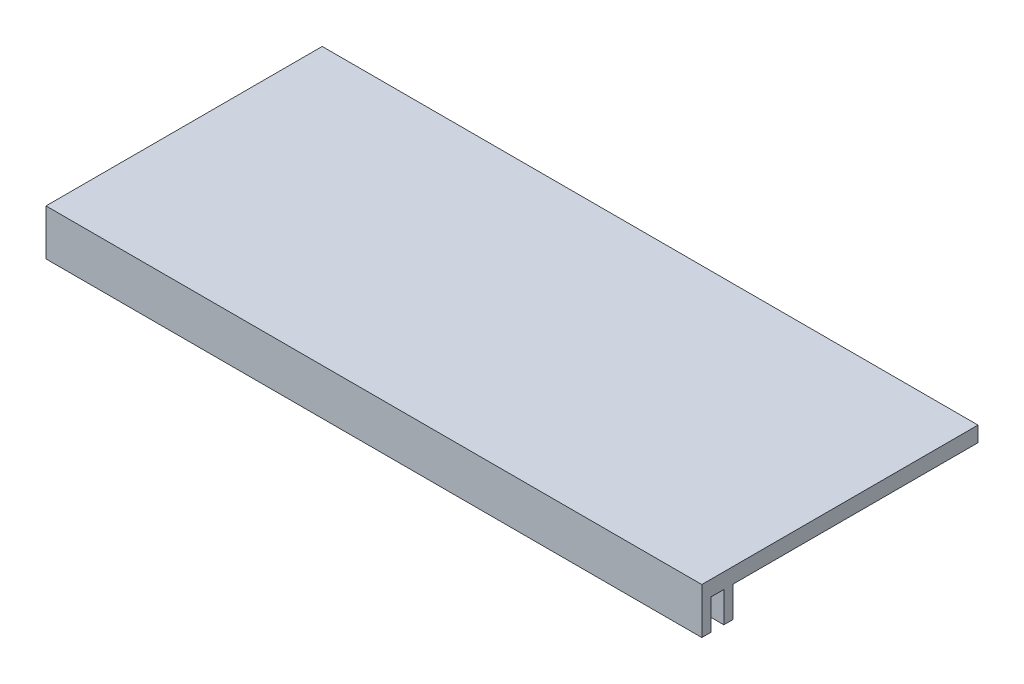
from build123d import *

# Parameters (mm, degrees)
SKETCH1_W                = 20
SKETCH1_H                = 80
BOSS_EXTRUDE1_DEPTH      = 5
BOSS_EXTRUDE2_DEPTH      = 10
BOSS_EXTRUDE2_DEPTH_BACK = 5
SKETCH2_W                = 20
SKETCH2_H                = 10.2
SKETCH3_W                = 20
SKETCH3_H                = 4.2
CUT_EXTRUDE1_DEPTH       = 10
BOSS_EXTRUDE3_DEPTH      = 194.158928137


with BuildPart() as part:
    # Sketch1 → Boss-Extrude1 (new body)
    with BuildSketch(Plane(origin=(0, 0, 0), x_dir=(1, 0, 0), z_dir=(0, 1, 0))):
        with Locations((10, 40)):
            Rectangle(SKETCH1_W, SKETCH1_H)
    extrude(amount=BOSS_EXTRUDE1_DEPTH)

    # Sketch2 → Boss-Extrude2 (add, two sides: drawn at the far end of the back side and taken through both)
    with BuildSketch(Plane.XZ.offset(-BOSS_EXTRUDE2_DEPTH_BACK)):
        with Locations((10, 5.1)):
            Rectangle(SKETCH2_W, SKETCH2_H)
    extrude(amount=BOSS_EXTRUDE2_DEPTH + BOSS_EXTRUDE2_DEPTH_BACK)

    # Sketch3 → Cut-Extrude1 (cut)
    with BuildSketch(Plane.XZ.offset(10)):
        with Locations((10, 5.1)):
            Rectangle(SKETCH3_W, SKETCH3_H)
    extrude(amount=-CUT_EXTRUDE1_DEPTH, mode=Mode.SUBTRACT)

    # Sketch5 → Boss-Extrude3 (add)
    with BuildSketch(Plane.ZY):
        Polygon((3, 0), (7.2, 0), (7.2, 5), (-80, 5), (-80, 0), (0, 0), (0, -10), (3, -10), align=None)
        Polygon((7.2, -10), (10.2, -10), (10.2, 5), (7.2, 5), (7.2, 0), align=None)
    extrude(amount=BOSS_EXTRUDE3_DEPTH)


solid = part.part
